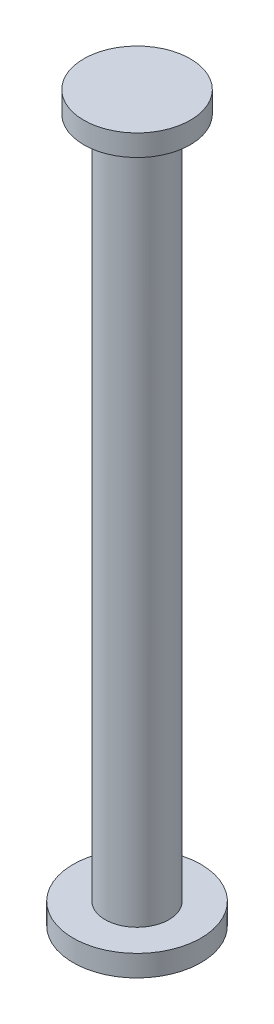
from build123d import *

# Parameters (mm, degrees)
CROQUIS1_R              = 75
SALIENTE_EXTRUIR1_DEPTH = 1600
CROQUIS2_R              = 125
SALIENTE_EXTRUIR2_DEPTH = 50
CROQUIS3_R              = 150
SALIENTE_EXTRUIR3_DEPTH = 50
CROQUIS4_W              = 70
CROQUIS4_H              = 20
CORTAR_EXTRUIR1_DEPTH   = 30


with BuildPart() as part:
    # Croquis1 → Saliente-Extruir1 (new body)
    with BuildSketch(Plane(origin=(0, 0, 0), x_dir=(1, 0, 0), z_dir=(0, 1, 0))):
        with Locations(Location((0, 0, 0), (0, 0, 270))):
            Circle(CROQUIS1_R)
    extrude(amount=SALIENTE_EXTRUIR1_DEPTH)

    # Croquis2 → Saliente-Extruir2 (add)
    with BuildSketch(Plane(origin=(0, 1600, 0), x_dir=(1, 0, 0), z_dir=(0, 1, 0))):
        with Locations(Location((0, 0, 0), (0, 0, 270))):
            Circle(CROQUIS2_R)
    extrude(amount=SALIENTE_EXTRUIR2_DEPTH)

    # Croquis3 → Saliente-Extruir3 (add)
    with BuildSketch(Plane.XZ):
        with Locations(Location((0, 0, 0), (0, 0, 270))):
            Circle(CROQUIS3_R)
    extrude(amount=SALIENTE_EXTRUIR3_DEPTH)

    # Croquis4 → Cortar-Extruir1 (cut)
    with BuildSketch(Plane.XZ.offset(50)):
        with Locations((-65, -5)):
            Rectangle(CROQUIS4_W, CROQUIS4_H)
        with Locations((65, -5)):
            Rectangle(CROQUIS4_W, CROQUIS4_H)
    extrude(amount=-CORTAR_EXTRUIR1_DEPTH, mode=Mode.SUBTRACT)


solid = part.part
